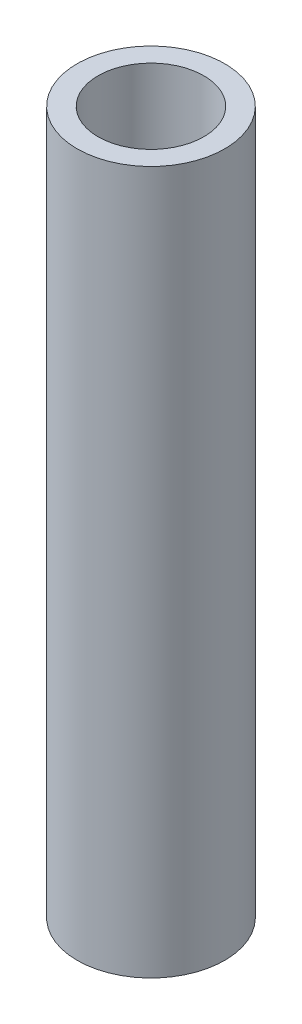
from build123d import *

# Parameters (mm, degrees)
SKETCH1_R           = 10.668
SKETCH1_R_2         = 7.6454
BOSS_EXTRUDE1_DEPTH = 101.6


with BuildPart() as part:
    # Sketch1 → Boss-Extrude1 (new body)
    with BuildSketch(Plane(origin=(0, 0, 0), x_dir=(1, 0, 0), z_dir=(0, 1, 0))):
        with Locations(Location((0, 0, 0), (0, 0, 270))):
            Circle(SKETCH1_R)
        with Locations(Location((0, 0, 0), (0, 0, 270))):
            Circle(SKETCH1_R_2, mode=Mode.SUBTRACT)
    extrude(amount=BOSS_EXTRUDE1_DEPTH)


solid = part.part
